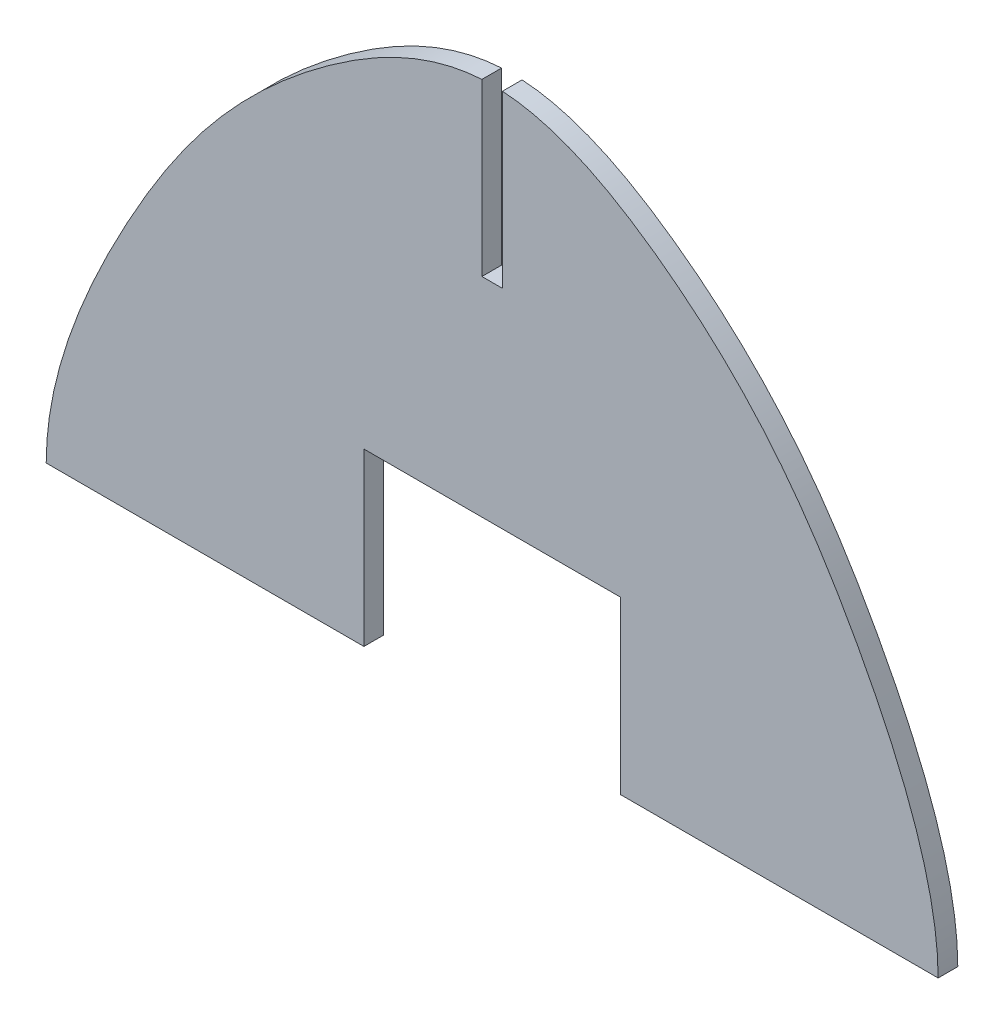
from build123d import *

# Parameters (mm, degrees)
BOSS_EXTRUDE1_DEPTH = 5.842
SKETCH3_W           = 38.1
SKETCH3_H           = 50.8
SKETCH3_W_2         = 3.048
CUT_EXTRUDE1_DEPTH  = 243.64734842


with BuildPart() as part:
    # Sketch2 → Boss-Extrude1 (new body)
    with BuildSketch(Plane.XY):
        with BuildLine():
            Line((132.489119036, 39.6875), (0, 39.6875))
            Line((0, 39.6875), (0, 203.2))
            add(Edge.make_bspline(
                [(0, 203.2), (17.235406981, 203.2), (50.061159208, 185.921315787), (85.218169736, 152.2019324), (115.206186784, 104.366247761), (132.489119036, 63.290972919), (132.489119036, 39.6875)],
                knots=[0, 0, 0, 0, 0.231795721, 0.463575912, 0.653721915, 1, 1, 1, 1], degree=3))
        make_face()
    extrude(amount=BOSS_EXTRUDE1_DEPTH)

    # Sketch3 → Cut-Extrude1 (cut, through all)
    with BuildSketch(Plane.XY.offset(5.842)):
        with Locations((19.05, 65.0875)):
            Rectangle(SKETCH3_W, SKETCH3_H)
        with Locations((1.524, 177.8)):
            Rectangle(SKETCH3_W_2, SKETCH3_H)
    extrude(amount=-CUT_EXTRUDE1_DEPTH, mode=Mode.SUBTRACT)

    # Mirror1: part across plane


with BuildPart() as part_1:
    add(part.part)
    add(part.part.mirror(Plane(origin=(0, 0, 0), x_dir=(0, 0, 1), z_dir=(1, 0, 0))))


solid = part_1.part
